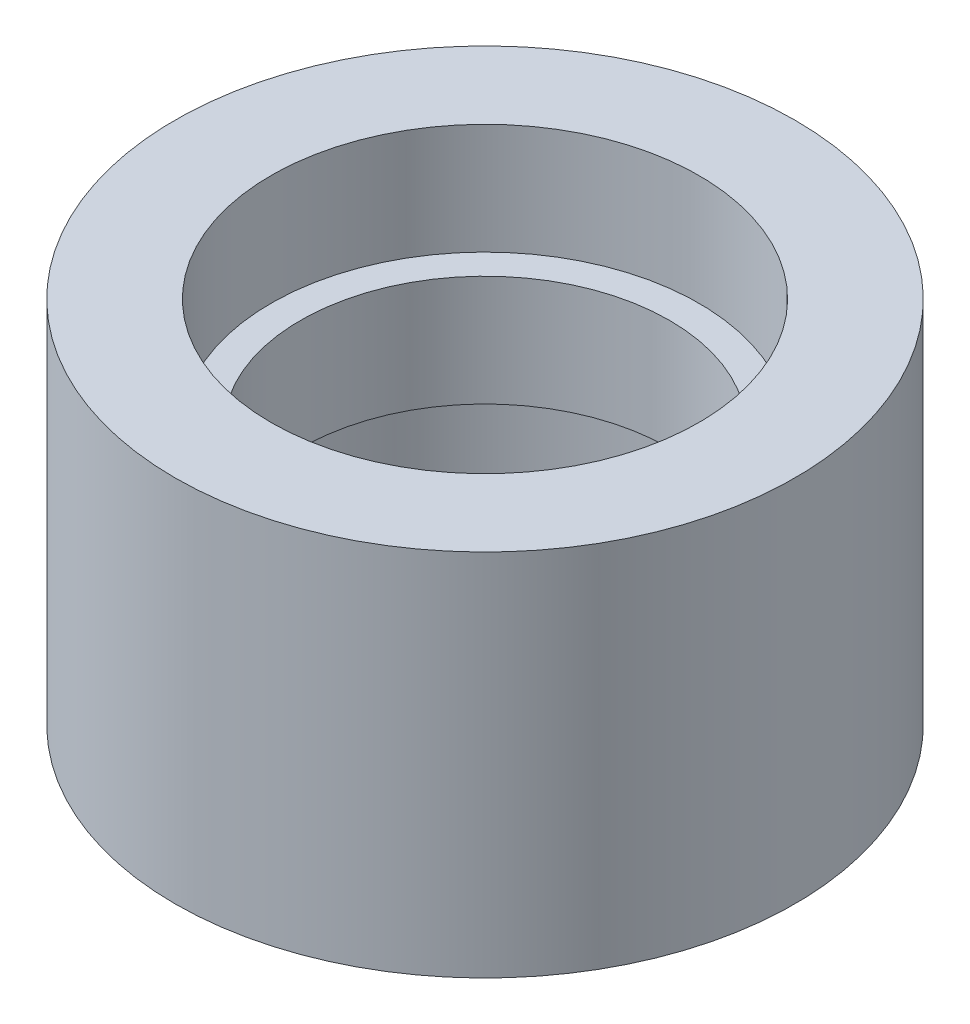
from build123d import *

# Parameters (mm, degrees)
SKETCH1_R             = 42
SKETCH1_R_2           = 25
EXTRUDE1_DEPTH        = 50
SKETCH3_R             = 29
EXTRUDE3_DEPTH        = 15
EXTRUDE4_START        = -20
SKETCH4_R             = 29
EXTRUDE4_DEPTH        = 20
SKETCH5_R             = 31
EXTRUDE5_DEPTH        = 9
M4_TAPPED_HOLE1_D     = 3.3
M4_TAPPED_HOLE1_DEPTH = 10.1
M4_TAPPED_HOLE1_TIP   = 0.991420021


with BuildPart() as part:
    # Sketch1 → Extrude1 (new body)
    with BuildSketch(Plane(origin=(0, 0, 0), x_dir=(1, 0, 0), z_dir=(0, 1, 0))):
        with Locations(Location((0, 0, 0), (0, 0, 270))):
            Circle(SKETCH1_R)
        with Locations(Location((0, 0, 0), (0, 0, 270))):
            Circle(SKETCH1_R_2, mode=Mode.SUBTRACT)
    extrude(amount=EXTRUDE1_DEPTH)

    # Sketch3 → Extrude3 (cut)
    with BuildSketch(Plane(origin=(0, 50, 0), x_dir=(1, 0, 0), z_dir=(0, 1, 0))):
        with Locations(Location((0, 0, 0), (0, 0, 270))):
            Circle(SKETCH3_R)
    extrude(amount=-EXTRUDE3_DEPTH, mode=Mode.SUBTRACT)

    # Sketch4 → Extrude4 (cut)
    with BuildSketch(Plane.XZ.offset(EXTRUDE4_START)):
        with Locations(Location((0, 0, 0), (0, 0, 90))):
            Circle(SKETCH4_R)
    extrude(amount=EXTRUDE4_DEPTH, mode=Mode.SUBTRACT)

    # Sketch5 → Extrude5 (cut)
    with BuildSketch(Plane.XZ):
        with Locations(Location((0, 0, 0), (0, 0, 270))):
            Circle(SKETCH5_R)
    extrude(amount=-EXTRUDE5_DEPTH, mode=Mode.SUBTRACT)

    # M4 Tapped Hole1
    with Locations(Plane(origin=(-24, 0, 24), x_dir=(0, 0, -1), z_dir=(0, -1, 0))):
        with Locations((0, 0), (0, 48), (48, 0), (48, 48)):
            Hole(M4_TAPPED_HOLE1_D / 2, depth=M4_TAPPED_HOLE1_DEPTH)
            with Locations((0, 0, -(M4_TAPPED_HOLE1_DEPTH + M4_TAPPED_HOLE1_TIP / 2))):  # 118° drill point
                Cone(0, M4_TAPPED_HOLE1_D / 2, M4_TAPPED_HOLE1_TIP, mode=Mode.SUBTRACT)


solid = part.part
